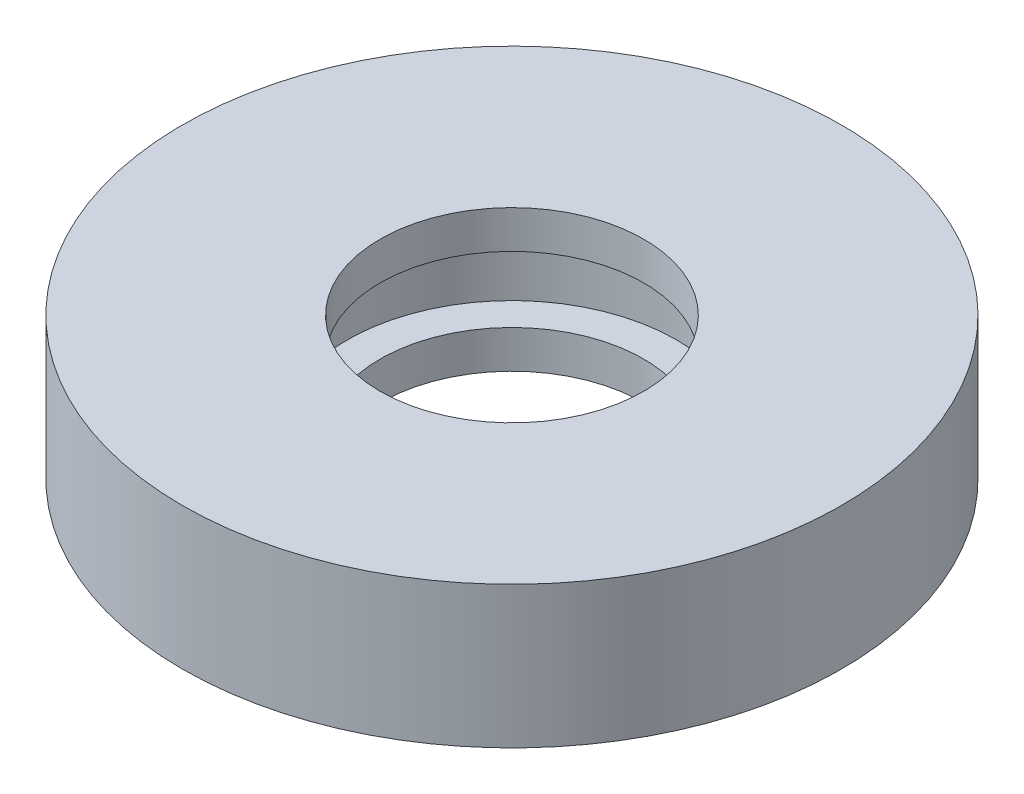
from build123d import *

# Parameters (mm, degrees)
CIRPATTERN1_COUNT = 6


with BuildPart() as part:
    # Sketch1 → Revolve1 (revolve)
    with BuildSketch(Plane(origin=(0, 0, 0), x_dir=(0, 0, -1), z_dir=(1, 0, 0))):
        Polygon((-250, 50), (-250, -50), (-200, -50), (-200, -107.5), (-220, -107.5), (-220, -82.5), (-275, -82.5), (-275, -107.5), (-500, -107.5), (-500, 107.5), (-200, 107.5), (-200, 50), align=None)
    revolve(axis=Axis((0, 562.012987013, 0), (0, -1, 0)))

    # Sketch2 → Cut-Revolve1 (revolve, cut)
    with BuildSketch(Plane.XY):
        with BuildLine():
            Line((-375, 100), (-375, -100))
            ThreePointArc((-375, -100), (-475, 0), (-375, 100))
        make_face()
    cut_revolve1 = revolve(axis=Axis((-375, 100, 0), (0, -1, 0)), mode=Mode.SUBTRACT)

    # CirPattern1: Cut-Revolve1 ×6 about axis
    cirpattern1_axis = Axis((0, 0, 0), (0, 1, 0))
    for i in range(1, CIRPATTERN1_COUNT):
        add(cut_revolve1.rotate(cirpattern1_axis, i * 360 / CIRPATTERN1_COUNT), mode=Mode.SUBTRACT)


solid = part.part
